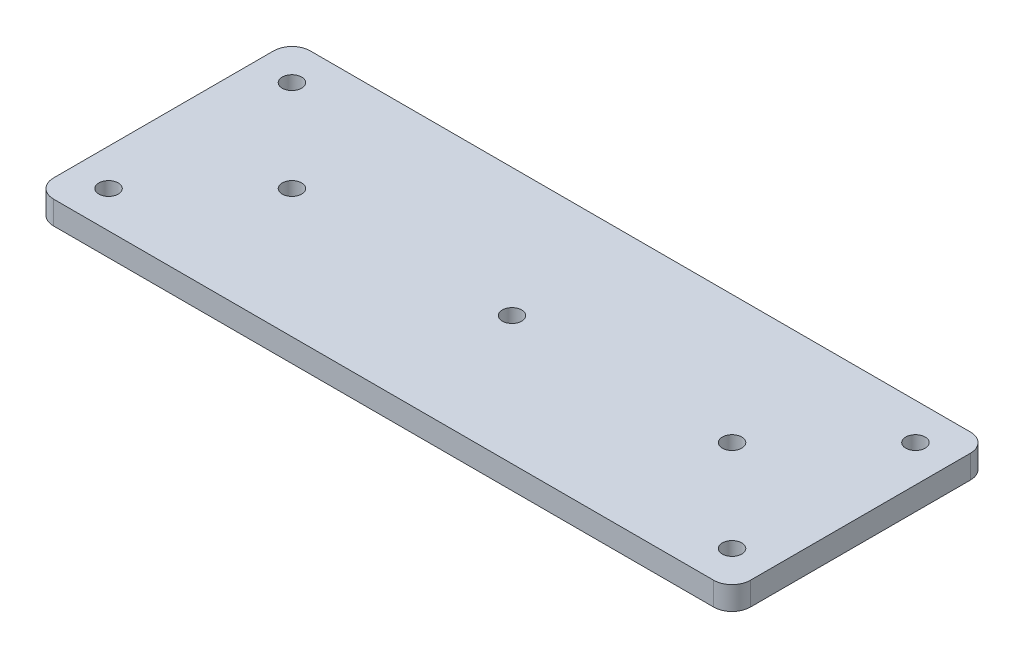
from build123d import *

# Parameters (mm, degrees)
SKETCH1_W            = 190
SKETCH1_H            = 70
BOSS_EXTRUDE1_DEPTH  = 6.35
M5_CLEARANCE_HOLE1_D = 5.3
FILLET1_R            = 5


with BuildPart() as part:
    # Sketch1 → Boss-Extrude1 (new body)
    with BuildSketch(Plane(origin=(0, 0, 0), x_dir=(1, 0, 0), z_dir=(0, 1, 0))):
        Rectangle(SKETCH1_W, SKETCH1_H)
    extrude(amount=-BOSS_EXTRUDE1_DEPTH)

    # M5 Clearance Hole1 (through all)
    with Locations(Plane(origin=(-85, 0, -25), x_dir=(0, 0, 1), z_dir=(0, 1, 0))):
        with Locations((0, 0), (50, 0), (25, 145), (0, 170), (25, 85), (25, 25), (50, 170)):
            Hole(M5_CLEARANCE_HOLE1_D / 2)

    # Fillet1
    fillet1_edges = [part.edges().sort_by_distance(p)[0] for p in [
        (-95, -3.175, -35),
        (95, -3.175, -35),
        (95, -3.175, 35),
        (-95, -3.175, 35),
    ]]
    fillet(fillet1_edges, radius=FILLET1_R)


solid = part.part
